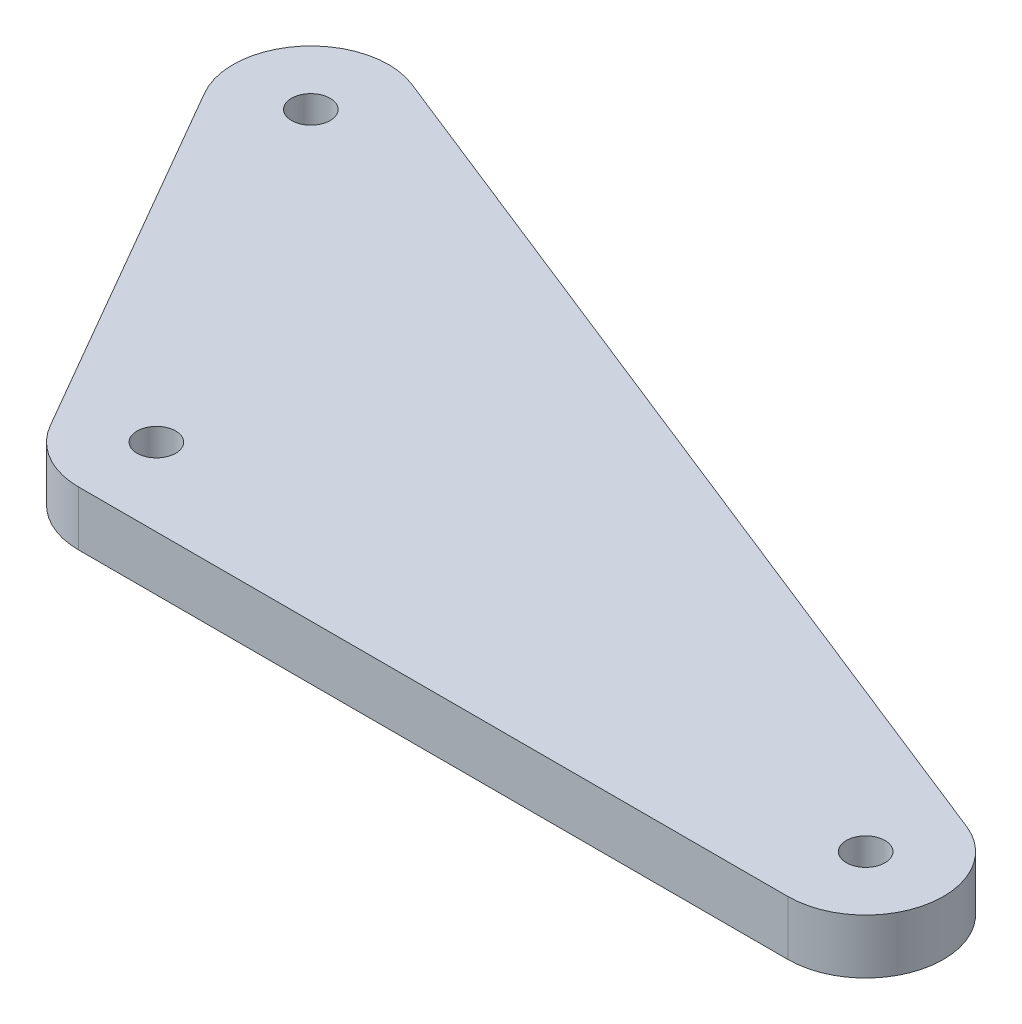
from build123d import *

# Parameters (mm, degrees)
BOSS_EXTRUDE1_DEPTH  = 6.35
M4_CLEARANCE_HOLE1_D = 4.5


with BuildPart() as part:
    # Sketch3 → Boss-Extrude1 (new body)
    with BuildSketch(Plane(origin=(0, 0, 0), x_dir=(1, 0, 0), z_dir=(0, 1, 0))):
        with BuildLine():
            Line((-103.762341406, 50.934626006), (3.339213875, 8.410084854))
            ThreePointArc((3.339213875, 8.410084854), (8.88764963, -1.699870765), (0, -9.04875))
            Line((0, -9.04875), (-82.55, -9.04875))
            ThreePointArc((-82.55, -9.04875), (-87.074375, -7.836447372), (-90.386447372, -4.524375))
            Line((-90.386447372, -4.524375), (-114.938002654, 38.000166152))
            ThreePointArc((-114.938002654, 38.000166152), (-113.948550258, 48.440497232), (-103.762341406, 50.934626006))
        make_face()
    extrude(amount=BOSS_EXTRUDE1_DEPTH)

    # M4 Clearance Hole1 (through all)
    with Locations(Plane(origin=(0, 6.35, 0), x_dir=(1, 0, 0), z_dir=(0, 1, 0))):
        with Locations((-107.101555281, 42.524541152), (-82.55, 0), (0, 0)):
            Hole(M4_CLEARANCE_HOLE1_D / 2)


solid = part.part
